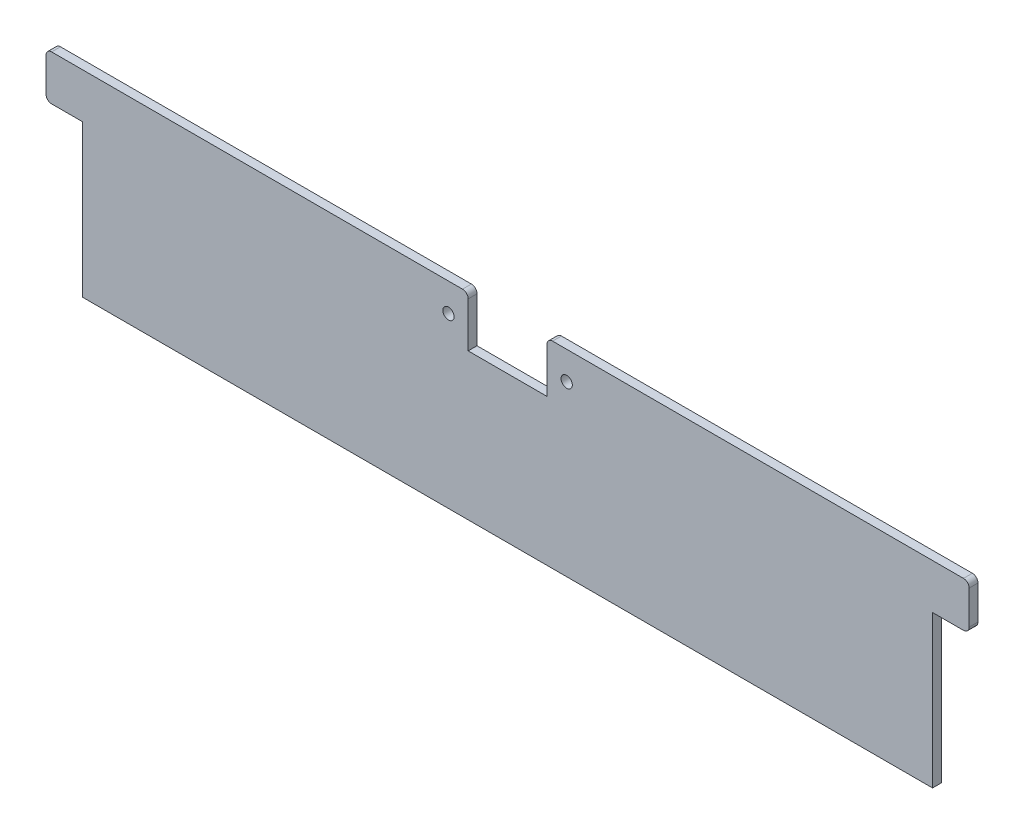
from build123d import *

# Parameters (mm, degrees)
BOSS_EXTRUDE1_DEPTH         = 2.5
SKETCH2_W                   = 44.45
SKETCH2_H                   = 28.575
CUT_EXTRUDE1_DEPTH          = 270.196752221
FILLET1_R                   = 3.175
F_1_4_0_25_DIAMETER_HOLE1_D = 6.35


with BuildPart() as part:
    # Sketch1 → Boss-Extrude1 (new, symmetric)
    with BuildSketch(Plane.XY):
        Polygon((-260.35, 68.2625), (260.35, 68.2625), (260.35, 42.8625), (239.7125, 42.8625), (239.7125, -42.8625), (-239.7125, -42.8625), (-239.7125, 42.8625), (-260.35, 42.8625), align=None)
    extrude(amount=BOSS_EXTRUDE1_DEPTH, both=True)

    # Sketch2 → Cut-Extrude1 (cut, through all)
    with BuildSketch(Plane.XY.offset(2.5)):
        with Locations((0, 53.975)):
            Rectangle(SKETCH2_W, SKETCH2_H)
    extrude(amount=-CUT_EXTRUDE1_DEPTH, mode=Mode.SUBTRACT)

    # Fillet1
    fillet1_edges = [part.edges().sort_by_distance(p)[0] for p in [
        (-260.35, 68.2625, 0),
        (260.35, 68.2625, 0),
        (260.35, 42.8625, 0),
        (-260.35, 42.8625, 0),
        (22.225, 68.2625, 0),
        (-22.225, 68.2625, 0),
    ]]
    fillet(fillet1_edges, radius=FILLET1_R)

    # 1/4 (0.25) Diameter Hole1 (through all)
    with Locations(Plane.XY.offset(2.5)):
        with Locations((-33.3375, 52.3875), (33.3375, 52.3875)):
            Hole(F_1_4_0_25_DIAMETER_HOLE1_D / 2)


solid = part.part
